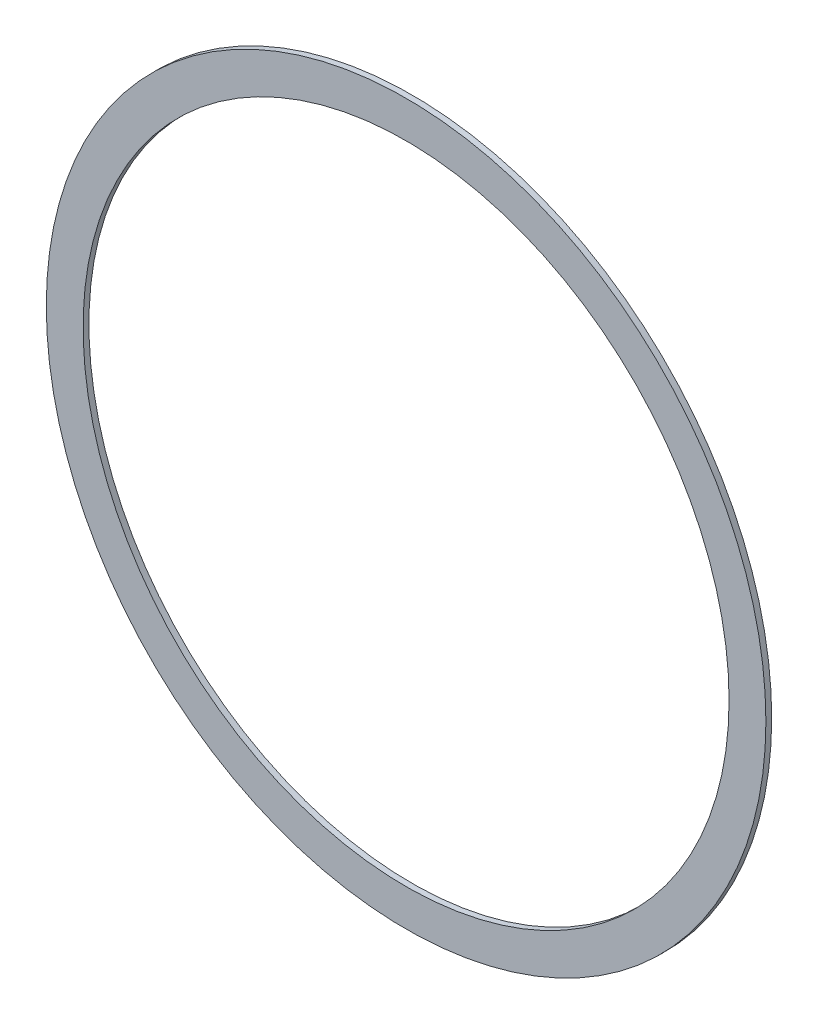
from build123d import *

# Parameters (mm, degrees)
SKETCH1_R           = 278.5
SKETCH1_R_2         = 250
BOSS_EXTRUDE1_DEPTH = 4.5


with BuildPart() as part:
    # Sketch1 → Boss-Extrude1 (new body)
    with BuildSketch(Plane.XY):
        Circle(SKETCH1_R)
        Circle(SKETCH1_R_2, mode=Mode.SUBTRACT)
    extrude(amount=BOSS_EXTRUDE1_DEPTH)


solid = part.part
